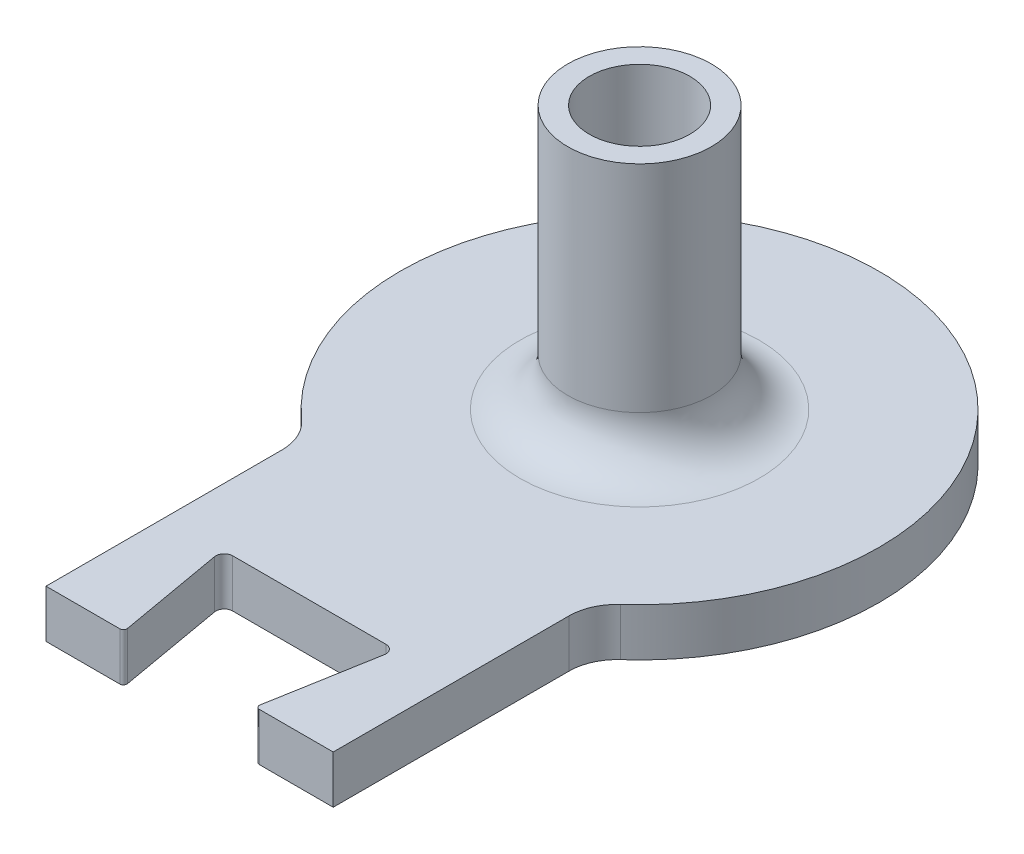
from build123d import *

# Parameters (mm, degrees)
SKETCH1_R           = 0.25
BOSS_EXTRUDE1_DEPTH = 2
SKETCH2_R           = 10
SKETCH2_R_2         = 3
BOSS_EXTRUDE2_DEPTH = 2
SKETCH4_W           = 12
SKETCH4_H           = 0.2
CUT_EXTRUDE1_DEPTH  = 4
FILLET3_R           = 0.35
FILLET4_R           = 0.15
SKETCH5_R           = 3
SKETCH5_R_2         = 2.1
BOSS_EXTRUDE4_DEPTH = 13
FILLET5_R           = 2
FILLET6_R           = 2


with BuildPart() as part:
    # Sketch1 → Boss-Extrude1 (new body)
    with BuildSketch(Plane(origin=(0, 0, 0), x_dir=(1, 0, 0), z_dir=(0, 1, 0))):
        Polygon((-6, 6), (-6, -13.291502622), (-6, -19), (-2.70227506, -19), (-3.619175359, -13.8), (0, -13.8), (3.619175359, -13.8), (2.70227506, -19), (6, -19), (6, -13.291502622), (6, 6), align=None)
        with Locations(Location((0, 0, 0), (0, 0, 270))):
            Circle(SKETCH1_R, mode=Mode.SUBTRACT)
    extrude(amount=BOSS_EXTRUDE1_DEPTH)

    # Sketch2 → Boss-Extrude2 (add)
    with BuildSketch(Plane(origin=(0, 0, 0), x_dir=(1, 0, 0), z_dir=(0, 1, 0))):
        Circle(SKETCH2_R)
        Circle(SKETCH2_R_2, mode=Mode.SUBTRACT)
    extrude(amount=BOSS_EXTRUDE2_DEPTH)

    # Sketch4 → Cut-Extrude1 (cut)
    with BuildSketch(Plane(origin=(0, 2, 0), x_dir=(1, 0, 0), z_dir=(0, 1, 0))):
        with Locations((0, -18.9)):
            Rectangle(SKETCH4_W, SKETCH4_H)
    extrude(amount=-CUT_EXTRUDE1_DEPTH, mode=Mode.SUBTRACT)

    # Fillet3
    fillet3_edges = [part.edges().sort_by_distance(p)[0] for p in [
        (3.619175359, 1, 13.8),
        (-3.619175359, 1, 13.8),
    ]]
    fillet(fillet3_edges, radius=FILLET3_R)

    # Fillet4
    fillet4_edges = [part.edges().sort_by_distance(p)[0] for p in [
        (2.737540456, 1, 18.8),
        (-2.737540456, 1, 18.8),
    ]]
    fillet(fillet4_edges, radius=FILLET4_R)

    # Sketch5 → Boss-Extrude4 (add)
    with BuildSketch(Plane(origin=(0, 0, 0), x_dir=(1, 0, 0), z_dir=(0, 1, 0))):
        with Locations(Location((0, 0, 0), (0, 0, 90))):
            Circle(SKETCH5_R)
        with Locations(Location((0, 0, 0), (0, 0, 90))):
            Circle(SKETCH5_R_2, mode=Mode.SUBTRACT)
    extrude(amount=BOSS_EXTRUDE4_DEPTH)

    # Fillet5
    fillet5_edges = [part.edges().sort_by_distance(p)[0] for p in [
        (0, 2, 3),
    ]]
    fillet(fillet5_edges, radius=FILLET5_R)

    # Fillet6
    fillet6_edges = [part.edges().sort_by_distance(p)[0] for p in [
        (6, 1, 8),
        (-6, 1, 8),
    ]]
    fillet(fillet6_edges, radius=FILLET6_R)


solid = part.part
